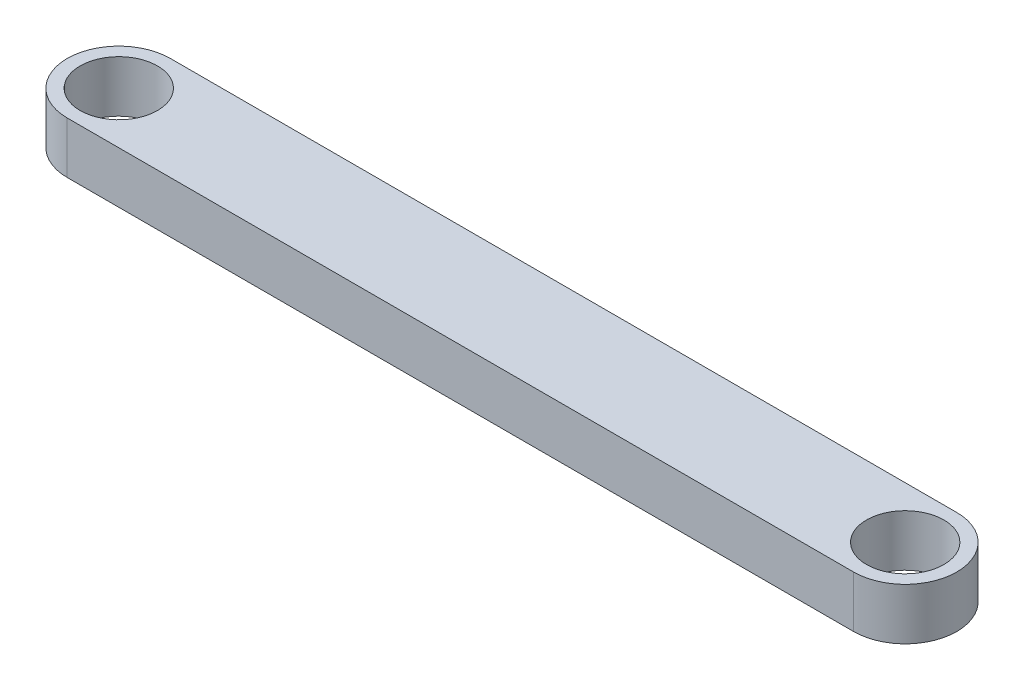
from build123d import *

# Parameters (mm, degrees)
SKETCH1_R           = 1.5
BOSS_EXTRUDE2_DEPTH = 2


with BuildPart() as part:
    # Sketch1 → Boss-Extrude2 (new body)
    with BuildSketch(Plane(origin=(0, 0, 0), x_dir=(1, 0, 0), z_dir=(0, 1, 0))):
        with BuildLine():
            Line((-97.43016209, 24.336855049), (-66.93016209, 24.336855049))
            ThreePointArc((-66.93016209, 24.336855049), (-64.93016209, 22.336855049), (-66.93016209, 20.336855049))
            Line((-66.93016209, 20.336855049), (-97.43016209, 20.336855049))
            ThreePointArc((-97.43016209, 20.336855049), (-99.43016209, 22.336855049), (-97.43016209, 24.336855049))
        make_face()
        with Locations(Location((-97.43016209, 22.336855049, 0), (0, 0, 270))):
            Circle(SKETCH1_R, mode=Mode.SUBTRACT)
        with Locations(Location((-66.93016209, 22.336855049, 0), (0, 0, 270))):
            Circle(SKETCH1_R, mode=Mode.SUBTRACT)
    extrude(amount=BOSS_EXTRUDE2_DEPTH)


solid = part.part
